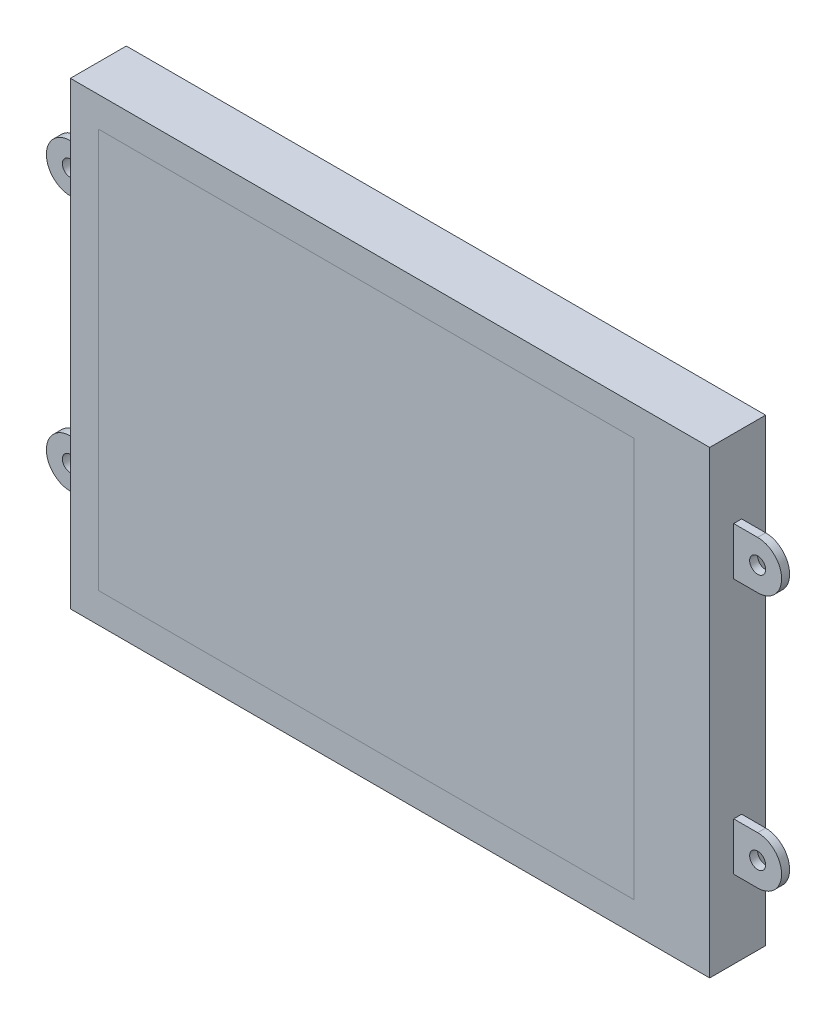
from build123d import *

# Parameters (mm, degrees)
SKETCH1_W           = 80
SKETCH1_H           = 57.5
BOSS_EXTRUDE1_DEPTH = 3.5
SKETCH3_R           = 1
BOSS_EXTRUDE2_DEPTH = 0.5


with BuildPart() as part:
    # Sketch1 → Boss-Extrude1 (new, symmetric)
    with BuildSketch(Plane.XY):
        Rectangle(SKETCH1_W, SKETCH1_H)
    extrude(amount=BOSS_EXTRUDE1_DEPTH, both=True)

    # Sketch3 → Boss-Extrude2 (add, symmetric)
    # profile 1 of 4: a face of its own
    with BuildSketch(Plane.XY):
        with BuildLine():
            Line((40, 19), (43, 19))
            ThreePointArc((43, 19), (46, 16), (43, 13))
            Line((43, 13), (40, 13))
            Line((40, 13), (40, 19))
        make_face()
        with Locations((43, 16)):
            Circle(SKETCH3_R, mode=Mode.SUBTRACT)
    # profile 2 of 4: a face of its own
    with BuildSketch(Plane.XY):
        with BuildLine():
            Line((43, -19), (40, -19))
            Line((40, -19), (40, -13))
            Line((40, -13), (43, -13))
            ThreePointArc((43, -13), (46, -16), (43, -19))
        make_face()
        with Locations((43, -16)):
            Circle(SKETCH3_R, mode=Mode.SUBTRACT)
    # profile 3 of 4: a face of its own
    with BuildSketch(Plane.XY):
        with BuildLine():
            Line((-43, 19), (-40, 19))
            Line((-40, 19), (-40, 13))
            Line((-40, 13), (-43, 13))
            ThreePointArc((-43, 13), (-46, 16), (-43, 19))
        make_face()
        with Locations((-43, 16)):
            Circle(SKETCH3_R, mode=Mode.SUBTRACT)
    # profile 4 of 4: a face of its own
    with BuildSketch(Plane.XY):
        with BuildLine():
            Line((-43, -13), (-40, -13))
            Line((-40, -13), (-40, -19))
            Line((-40, -19), (-43, -19))
            ThreePointArc((-43, -19), (-46, -16), (-43, -13))
        make_face()
        with Locations((-43, -16)):
            Circle(SKETCH3_R, mode=Mode.SUBTRACT)
    extrude(amount=BOSS_EXTRUDE2_DEPTH, both=True)


solid = part.part
